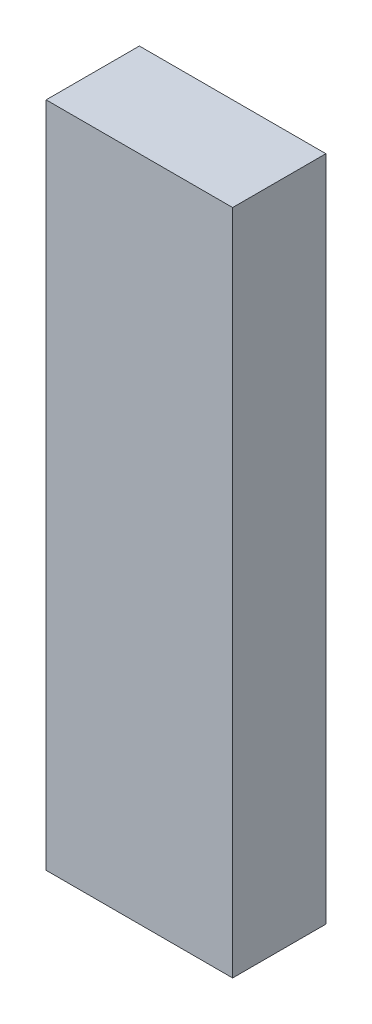
from build123d import *

# Parameters (mm, degrees)
SKETCH1_W           = 101.6
SKETCH1_H           = 50.8
BOSS_EXTRUDE1_DEPTH = 363.474


with BuildPart() as part:
    # Sketch1 → Boss-Extrude1 (new body)
    with BuildSketch(Plane(origin=(0, 0, 0), x_dir=(1, 0, 0), z_dir=(0, 1, 0))):
        Rectangle(SKETCH1_W, SKETCH1_H)
    extrude(amount=BOSS_EXTRUDE1_DEPTH)


solid = part.part
